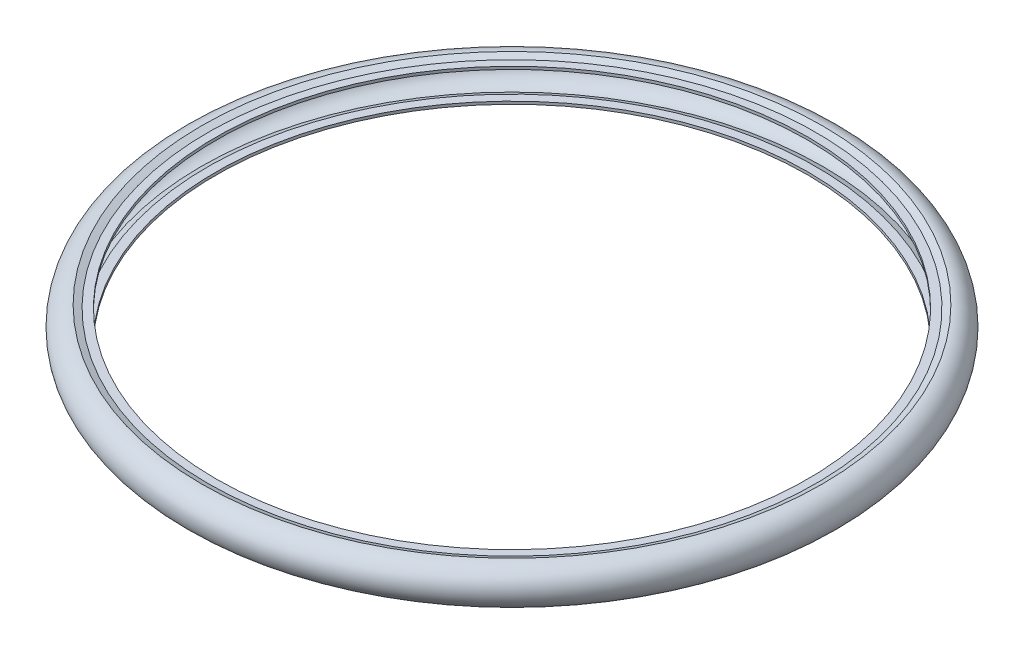
from build123d import *


with BuildPart() as part:
    # Sketch1 → Revolve1 (revolve)
    with BuildSketch(Plane(origin=(0, 0, 0), x_dir=(0, 0, -1), z_dir=(1, 0, 0)), mode=Mode.PRIVATE) as revolve1_sk:
        with BuildLine():
            Line((217.594560556, -10), (215.594560556, -10))
            Line((215.594560556, -10), (215.594560556, -12))
            Line((215.594560556, -12), (221.437329759, -12))
            Line((221.437329759, -12), (226.035038621, -13.964961379))
            ThreePointArc((226.035038621, -13.964961379), (240, 0), (226.035038621, 13.964961379))
            Line((226.035038621, 13.964961379), (221.437329759, 12))
            Line((221.437329759, 12), (215.594560556, 12))
            Line((215.594560556, 12), (215.594560556, 10))
            Line((215.594560556, 10), (217.594560556, 10))
            Line((217.594560556, 10), (221.846794436, 10))
            Line((221.846794436, 10), (226.42930017, 11.958463891))
            ThreePointArc((226.42930017, 11.958463891), (238, 0), (226.42930017, -11.958463891))
            Line((226.42930017, -11.958463891), (221.846794436, -10))
            Line((221.846794436, -10), (217.594560556, -10))
        make_face()
    revolve(revolve1_sk.sketch.rotate(Axis((0, 21.897389464, 0), (0, -1, 0)), 180), axis=Axis((0, 21.897389464, 0), (0, -1, 0)))


solid = part.part
